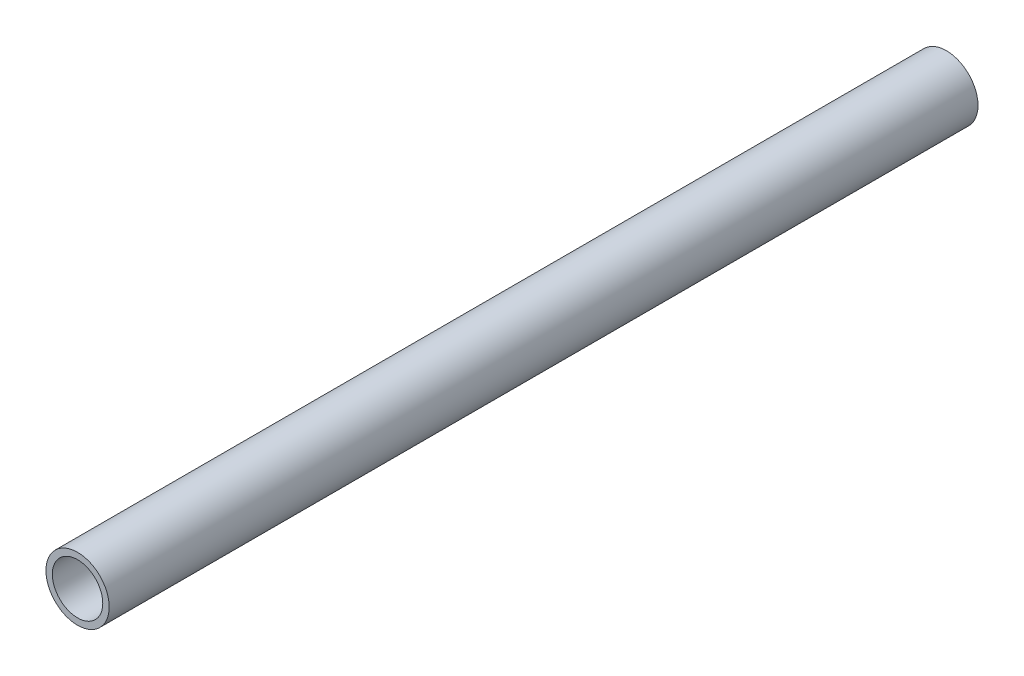
from build123d import *

# Parameters (mm, degrees)
SKETCH1_R           = 16.7005
SKETCH1_R_2         = 13.3223
BOSS_EXTRUDE1_DEPTH = 229.5


with BuildPart() as part:
    # Sketch1 → Boss-Extrude1 (new, symmetric)
    with BuildSketch(Plane.XY):
        Circle(SKETCH1_R)
        Circle(SKETCH1_R_2, mode=Mode.SUBTRACT)
    extrude(amount=BOSS_EXTRUDE1_DEPTH, both=True)


solid = part.part
